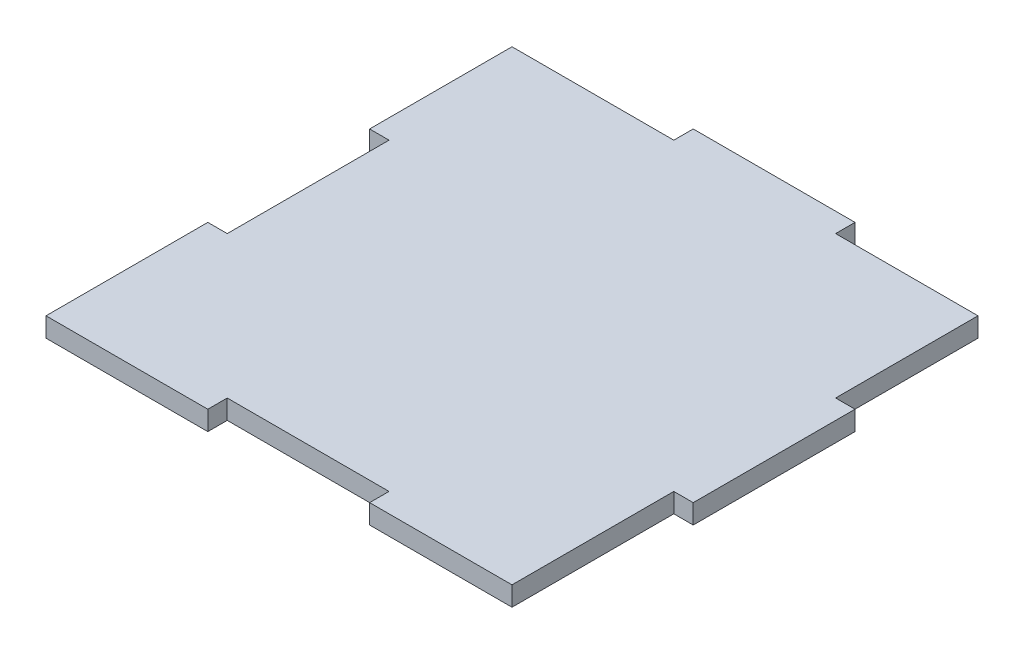
from build123d import *

# Parameters (mm, degrees)
SKETCH1_W           = 50
SKETCH1_H           = 6
SKETCH1_W_2         = 6
SKETCH1_H_2         = 50
BOSS_EXTRUDE1_DEPTH = 6


with BuildPart() as part:
    # Sketch1 → Boss-Extrude1 (new body)
    with BuildSketch(Plane(origin=(0, 0, 0), x_dir=(1, 0, 0), z_dir=(0, 1, 0))):
        Polygon((-72, 72), (-72, 28), (-66, 28), (-66, -22), (-72, -22), (-72, -72), (-22, -72), (-22, -66), (28, -66), (28, -72), (72, -72), (72, -22), (72, 28), (72, 72), (28, 72), (-22, 72), align=None)
        with Locations((3, 75)):
            Rectangle(SKETCH1_W, SKETCH1_H)
        with Locations((75, 3)):
            Rectangle(SKETCH1_W_2, SKETCH1_H_2)
    extrude(amount=BOSS_EXTRUDE1_DEPTH)


solid = part.part
